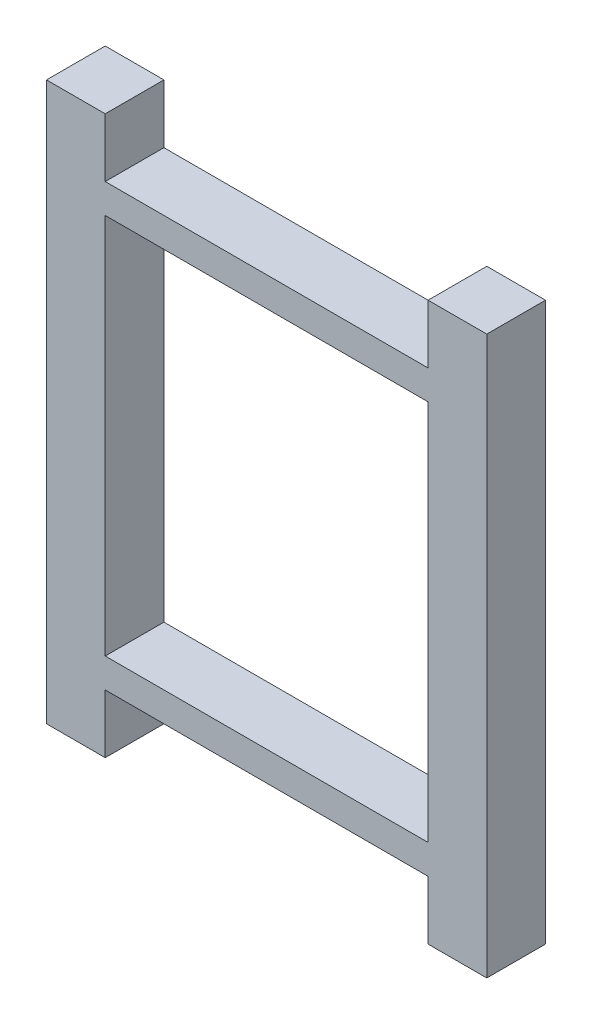
from build123d import *

# Parameters (mm, degrees)
SKETCH2_W           = 33
SKETCH2_H           = 39
BOSS_EXTRUDE1_DEPTH = 6


with BuildPart() as part:
    # Sketch2 → Boss-Extrude1 (new body)
    with BuildSketch(Plane.XY):
        Polygon((-6, 0), (0, 0), (0, 57), (-6, 57), (-6, 51), (-39, 51), (-39, 57), (-45, 57), (-45, 0), (-39, 0), (-39, 6), (-6, 6), align=None)
        with Locations((-22.5, 28.5)):
            Rectangle(SKETCH2_W, SKETCH2_H, mode=Mode.SUBTRACT)
    extrude(amount=BOSS_EXTRUDE1_DEPTH)


solid = part.part
